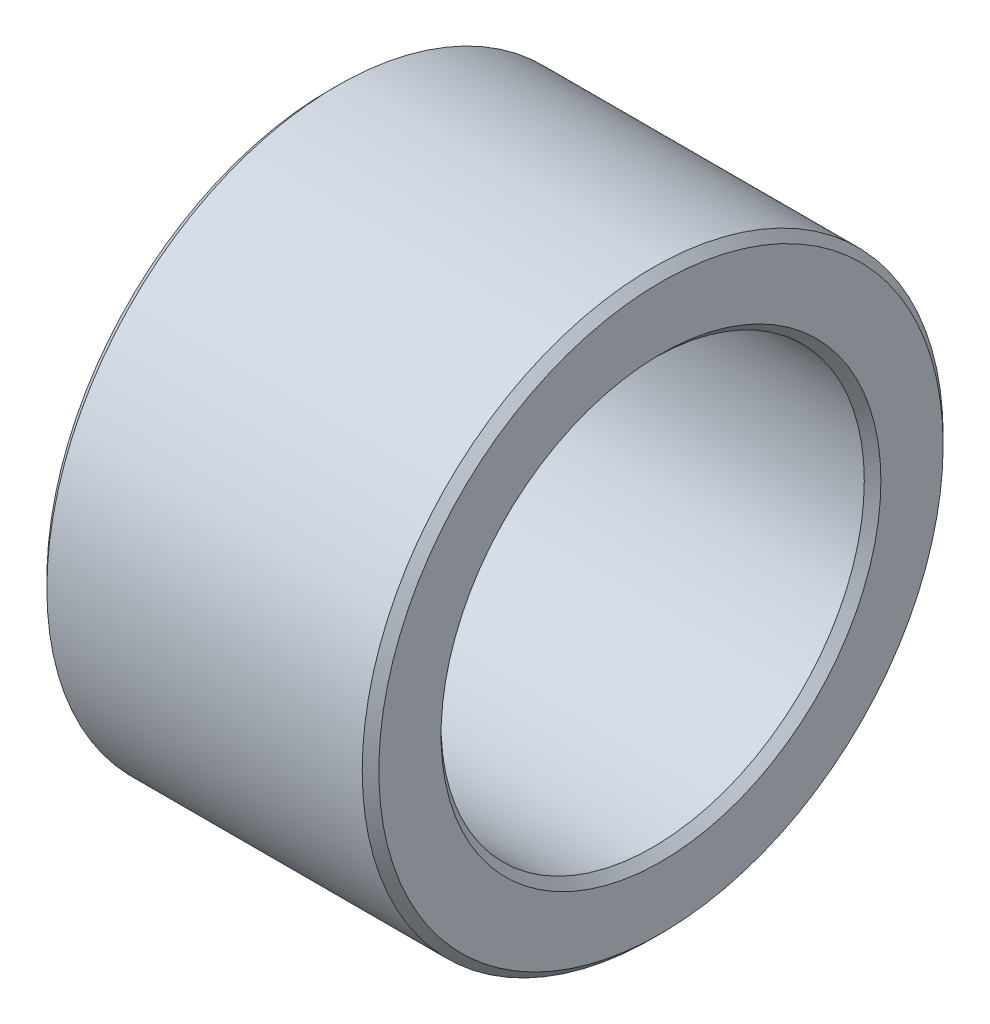
from build123d import *

# Parameters (mm, degrees)
SKETCH_1_R      = 3.5
SKETCH_1_R_2    = 2.55
EXTRUDE_1_DEPTH = 4
CHAMFER_1_SIZE  = 0.1


with BuildPart() as part:
    # 草图1 → 凸台-拉伸1 (new body)
    with BuildSketch(Plane.YZ):
        with Locations(Location((0, 0, 0), (0, 0, 270))):
            Circle(SKETCH_1_R)
        with Locations(Location((0, 0, 0), (0, 0, 270))):
            Circle(SKETCH_1_R_2, mode=Mode.SUBTRACT)
    extrude(amount=EXTRUDE_1_DEPTH)

    # 倒角1
    chamfer_1_edges = [part.edges().sort_by_distance(p)[0] for p in [
        (0, 0, 3.5),
        (4, 0, 3.5),
        (0, 0, 2.55),
        (4, 0, 2.55),
    ]]
    chamfer(chamfer_1_edges, length=CHAMFER_1_SIZE)


solid = part.part
